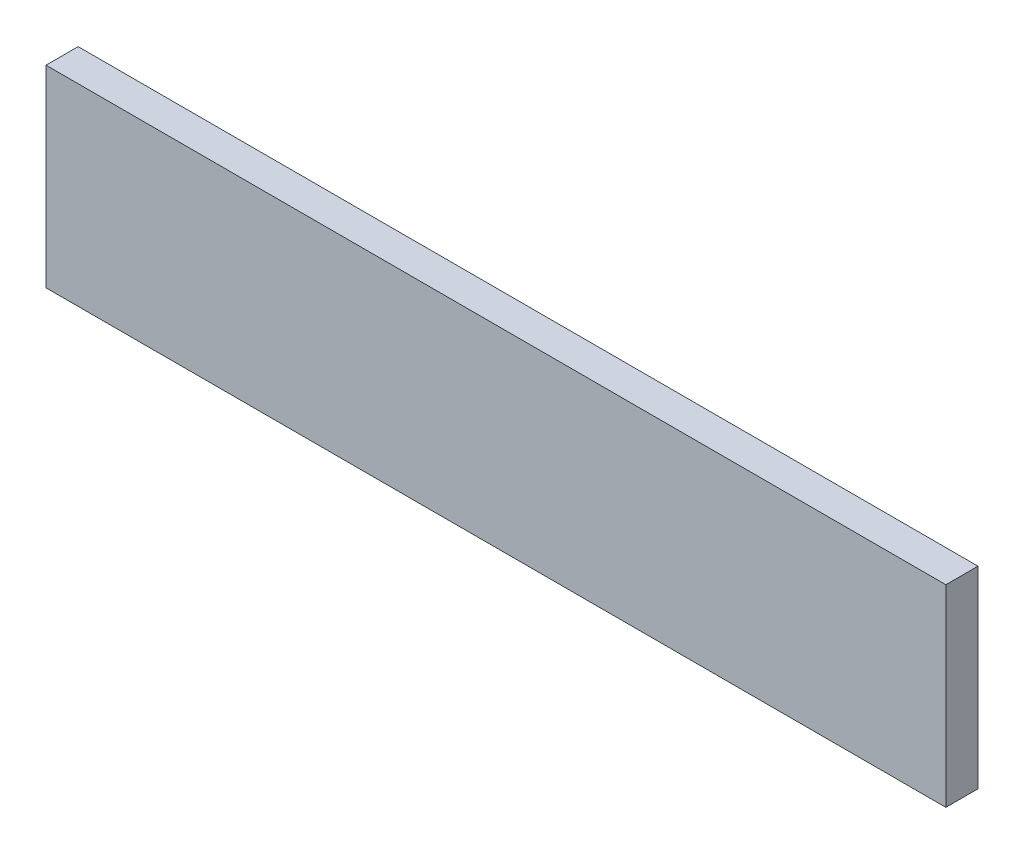
from build123d import *

# Parameters (mm, degrees)
SKETCH1_W           = 84
SKETCH1_H           = 18
BOSS_EXTRUDE1_DEPTH = 3


with BuildPart() as part:
    # Sketch1 → Boss-Extrude1 (new body)
    with BuildSketch(Plane.XY):
        Rectangle(SKETCH1_W, SKETCH1_H)
    extrude(amount=BOSS_EXTRUDE1_DEPTH)


solid = part.part
